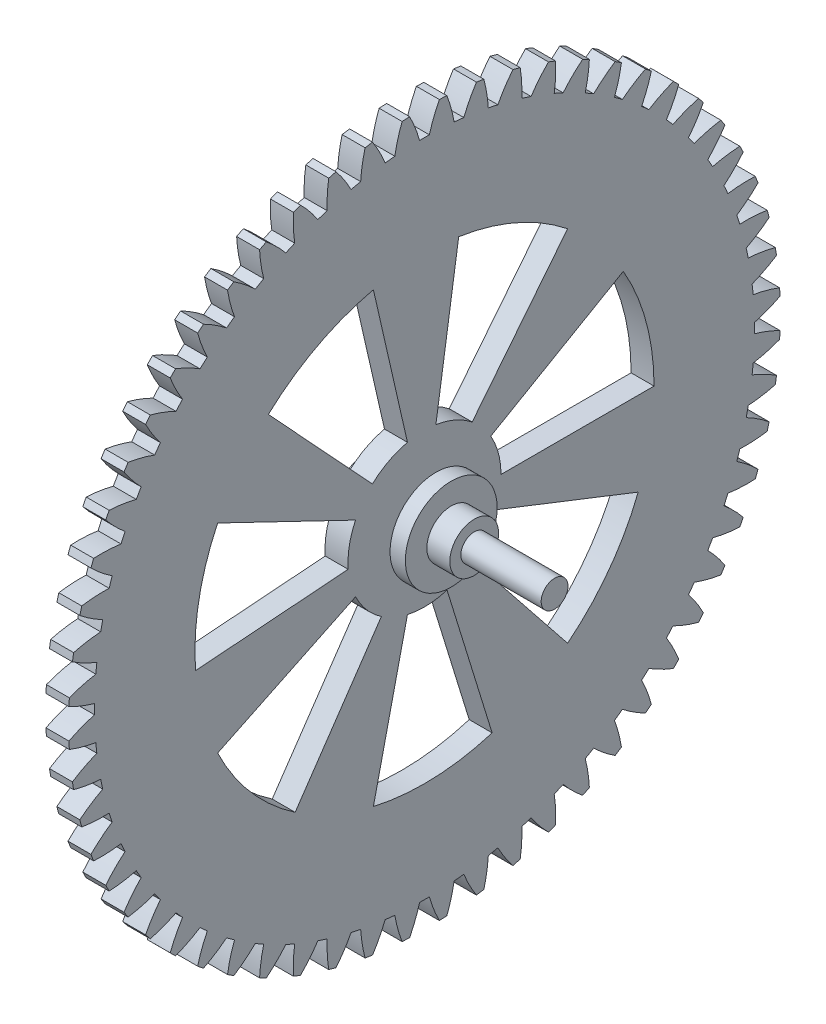
from build123d import *

# Parameters (mm, degrees)
BASPROSKE_W              = 3
BASPROSKE_H              = 46.5
TOOTHCUT_DEPTH           = 66.829324772
TEETHCUTS_COUNT          = 60
TEETHCUTS_ANGLE          = 354
BORSKE_R                 = 0.5
BORE_DEPTH               = 50.0000508
BOSS_EXTRUDE1_DEPTH      = 5
BOSS_EXTRUDE1_DEPTH_BACK = 20
SKETCH2_R                = 3.1875
BOSS_EXTRUDE5_START      = 1.5
SKETCH7_R                = 6
BOSS_EXTRUDE5_DEPTH      = 2
CUT_EXTRUDE1_REACH       = 69.867
CUT_EXTRUDE2_START       = -10.5
SKETCH9_R                = 3.1875
SKETCH9_R_2              = 1.75
CUT_EXTRUDE2_DEPTH       = 10.5


with BuildPart() as part:
    # BasProSke → Base-Revolve (revolve)
    with BuildSketch(Plane(origin=(0, 0, 0), x_dir=(1, 0, 0), z_dir=(0, 1, 0)), mode=Mode.PRIVATE) as base_revolve_sk:
        with Locations((1.5, 23.25)):
            Rectangle(BASPROSKE_W, BASPROSKE_H)
    revolve(base_revolve_sk.sketch.rotate(Axis((-10, 0, 0), (1, 0, 0)), 180), axis=Axis((-10, 0, 0), (1, 0, 0)))

    # TooCutSke → ToothCut (cut, through all)
    with BuildSketch(Plane(origin=(0, 0, 0), x_dir=(0, 0, -1), z_dir=(1, 0, 0))):
        with BuildLine():
            ThreePointArc((0.638657789, 43.119270544), (0, 43.124), (-0.638657789, 43.119270544))
            ThreePointArc((-0.638657789, 43.119270544), (-1.21237986, 44.83490593), (-1.955410143, 46.484289995))
            ThreePointArc((-1.955410143, 46.484289995), (0, 46.5254), (1.955410143, 46.484289995))
            ThreePointArc((1.955410143, 46.484289995), (1.21237986, 44.83490593), (0.638657789, 43.119270544))
        make_face()
    toothcut = extrude(amount=TOOTHCUT_DEPTH, mode=Mode.SUBTRACT)

    # TeethCuts: ToothCut ×60 about axis
    teethcuts_axis = Axis((-10, 0, 0), (1, 0, 0))
    for i in range(1, TEETHCUTS_COUNT):
        add(toothcut.rotate(teethcuts_axis, i * TEETHCUTS_ANGLE / (TEETHCUTS_COUNT - 1)), mode=Mode.SUBTRACT)

    # BorSke → Bore (cut, symmetric)
    with BuildSketch(Plane(origin=(0, 0, 0), x_dir=(0, 0, -1), z_dir=(1, 0, 0))):
        with Locations(Location((0, 0, 0), (0, 0, 180))):
            Circle(BORSKE_R)
    extrude(amount=BORE_DEPTH, both=True, mode=Mode.SUBTRACT)

    # Sketch2 → Boss-Extrude1 (add, two sides: drawn at the far end of the back side and taken through both)
    with BuildSketch(Plane.ZY.offset(-BOSS_EXTRUDE1_DEPTH_BACK)):
        Circle(SKETCH2_R)
    extrude(amount=BOSS_EXTRUDE1_DEPTH + BOSS_EXTRUDE1_DEPTH_BACK)

    # Sketch7 → Boss-Extrude5 (add)
    with BuildSketch(Plane(origin=(3, 0, 0), x_dir=(0, 0, -1), z_dir=(1, 0, 0)).offset(BOSS_EXTRUDE5_START)):
        Circle(SKETCH7_R)
    extrude(amount=BOSS_EXTRUDE5_DEPTH)

    # Sketch8 → Cut-Extrude1 (cut, up to next)
    with BuildSketch(Plane(origin=(3, 0, 0), x_dir=(0, 0, -1), z_dir=(1, 0, 0)), mode=Mode.PRIVATE) as cut_extrude1_sk1:
        with BuildLine():
            ThreePointArc((-9.009688679, 4.338837391), (-9.825664732, 1.859116072), (-9.972037972, -0.747300936))
            Line((-9.972037972, -0.747300936), (-29.916113915, -2.241902808))
            ThreePointArc((-29.916113915, -2.241902808), (-29.476994197, 5.577348215), (-27.029066037, 13.016512174))
            Line((-27.029066037, 13.016512174), (-9.009688679, 4.338837391))
        make_face()
    cut_extrude1_tool1 = extrude(cut_extrude1_sk1.sketch, amount=-CUT_EXTRUDE1_REACH, mode=Mode.PRIVATE) & part.part
    # Sketch8 → Cut-Extrude1 (cut, up to next)
    with BuildSketch(Plane(origin=(3, 0, 0), x_dir=(0, 0, -1), z_dir=(1, 0, 0)), mode=Mode.PRIVATE) as cut_extrude1_sk2:
        with BuildLine():
            ThreePointArc((-9.009688679, -4.338837391), (-7.579717231, -6.522874113), (-5.633200581, -8.262387743))
            Line((-5.633200581, -8.262387743), (-16.899601742, -24.787163229))
            ThreePointArc((-16.899601742, -24.787163229), (-22.739151694, -19.568622338), (-27.029066037, -13.016512174))
            Line((-27.029066037, -13.016512174), (-9.009688679, -4.338837391))
        make_face()
    cut_extrude1_tool2 = extrude(cut_extrude1_sk2.sketch, amount=-CUT_EXTRUDE1_REACH, mode=Mode.PRIVATE) & part.part
    # Sketch8 → Cut-Extrude1 (cut, up to next)
    with BuildSketch(Plane(origin=(3, 0, 0), x_dir=(0, 0, -1), z_dir=(1, 0, 0)), mode=Mode.PRIVATE) as cut_extrude1_sk3:
        with BuildLine():
            ThreePointArc((-2.22520934, -9.749279122), (0.373911943, -9.993007048), (2.947551744, -9.555728058))
            Line((2.947551744, -9.555728058), (8.842655232, -28.667184174))
            ThreePointArc((8.842655232, -28.667184174), (1.121735828, -29.979021144), (-6.675628019, -29.247837365))
            Line((-6.675628019, -29.247837365), (-2.22520934, -9.749279122))
        make_face()
    cut_extrude1_tool3 = extrude(cut_extrude1_sk3.sketch, amount=-CUT_EXTRUDE1_REACH, mode=Mode.PRIVATE) & part.part
    # Sketch8 → Cut-Extrude1 (cut, up to next)
    with BuildSketch(Plane(origin=(3, 0, 0), x_dir=(0, 0, -1), z_dir=(1, 0, 0)), mode=Mode.PRIVATE) as cut_extrude1_sk4:
        with BuildLine():
            ThreePointArc((6.234898019, -7.818314825), (8.045977798, -5.938201856), (9.308737486, -3.653410244))
            Line((9.308737486, -3.653410244), (27.926212459, -10.960230731))
            ThreePointArc((27.926212459, -10.960230731), (24.137933393, -17.814605567), (18.704694056, -23.454944474))
            Line((18.704694056, -23.454944474), (6.234898019, -7.818314825))
        make_face()
    cut_extrude1_tool4 = extrude(cut_extrude1_sk4.sketch, amount=-CUT_EXTRUDE1_REACH, mode=Mode.PRIVATE) & part.part
    # Sketch8 → Cut-Extrude1 (cut, up to next)
    with BuildSketch(Plane(origin=(3, 0, 0), x_dir=(0, 0, -1), z_dir=(1, 0, 0)), mode=Mode.PRIVATE) as cut_extrude1_sk5:
        with BuildLine():
            ThreePointArc((-2.22520934, 9.749279122), (-4.672686283, 8.841153935), (-6.801727378, 7.330518718))
            Line((-6.801727378, 7.330518718), (-20.405182133, 21.991556155))
            ThreePointArc((-20.405182133, 21.991556155), (-14.018058848, 26.523461805), (-6.675628019, 29.247837365))
            Line((-6.675628019, 29.247837365), (-2.22520934, 9.749279122))
        make_face()
    cut_extrude1_tool5 = extrude(cut_extrude1_sk5.sketch, amount=-CUT_EXTRUDE1_REACH, mode=Mode.PRIVATE) & part.part
    # Sketch8 → Cut-Extrude1 (cut, up to next)
    with BuildSketch(Plane(origin=(3, 0, 0), x_dir=(0, 0, -1), z_dir=(1, 0, 0)), mode=Mode.PRIVATE) as cut_extrude1_sk6:
        with BuildLine():
            Line((10, 0), (30, 0))
            ThreePointArc((30, 0), (28.977774789, 7.764571353), (25.980762114, 15))
            Line((25.980762114, 15), (8.660254038, 5))
            ThreePointArc((8.660254038, 5), (9.659258263, 2.588190451), (10, 0))
        make_face()
    cut_extrude1_tool6 = extrude(cut_extrude1_sk6.sketch, amount=-CUT_EXTRUDE1_REACH, mode=Mode.PRIVATE) & part.part
    # Sketch8 → Cut-Extrude1 (cut, up to next)
    with BuildSketch(Plane(origin=(3, 0, 0), x_dir=(0, 0, -1), z_dir=(1, 0, 0)), mode=Mode.PRIVATE) as cut_extrude1_sk7:
        with BuildLine():
            Line((6.234898019, 7.818314825), (18.704694056, 23.454944474))
            ThreePointArc((18.704694056, 23.454944474), (11.99676073, 27.496867676), (4.471267985, 29.664924787))
            Line((4.471267985, 29.664924787), (1.490422662, 9.888308262))
            ThreePointArc((1.490422662, 9.888308262), (3.998920243, 9.165622559), (6.234898019, 7.818314825))
        make_face()
    cut_extrude1_tool7 = extrude(cut_extrude1_sk7.sketch, amount=-CUT_EXTRUDE1_REACH, mode=Mode.PRIVATE) & part.part
    add(cut_extrude1_tool1.solids().sort_by_distance((3, 3.982229, 21.046585))[0], mode=Mode.SUBTRACT)
    add(cut_extrude1_tool2.solids().sort_by_distance((3, -13.972004, 16.235763))[0], mode=Mode.SUBTRACT)
    add(cut_extrude1_tool3.solids().sort_by_distance((3, -21.405033, -0.80092))[0], mode=Mode.SUBTRACT)
    add(cut_extrude1_tool4.solids().sort_by_distance((3, -12.719635, -17.234494))[0], mode=Mode.SUBTRACT)
    add(cut_extrude1_tool5.solids().sort_by_distance((3, 18.937762, 10.0089))[0], mode=Mode.SUBTRACT)
    add(cut_extrude1_tool6.solids().sort_by_distance((3, 5.543907, -20.690143))[0], mode=Mode.SUBTRACT)
    add(cut_extrude1_tool7.solids().sort_by_distance((3, 19.632774, -8.565692))[0], mode=Mode.SUBTRACT)

    # Sketch9 → Cut-Extrude2 (cut)
    with BuildSketch(Plane(origin=(20, 0, 0), x_dir=(0, 0, -1), z_dir=(1, 0, 0)).offset(CUT_EXTRUDE2_START)):
        Circle(SKETCH9_R)
        with Locations(Location((0, 0, 0), (0, 0, 180))):
            Circle(SKETCH9_R_2, mode=Mode.SUBTRACT)
    extrude(amount=CUT_EXTRUDE2_DEPTH, mode=Mode.SUBTRACT)


solid = part.part
